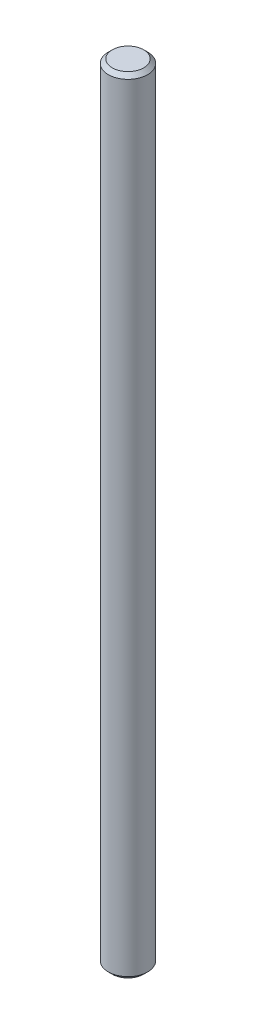
from build123d import *

# Parameters (mm, degrees)
SKETCH1_R           = 5
BOSS_EXTRUDE1_DEPTH = 200
CHAMFER1_SIZE       = 1


with BuildPart() as part:
    # Sketch1 → Boss-Extrude1 (new body)
    with BuildSketch(Plane(origin=(0, 0, 0), x_dir=(1, 0, 0), z_dir=(0, 1, 0))):
        with Locations(Location((0, 0, 0), (0, 0, 270))):
            Circle(SKETCH1_R)
    extrude(amount=BOSS_EXTRUDE1_DEPTH)

    # Chamfer1
    chamfer1_edges = [part.edges().sort_by_distance(p)[0] for p in [
        (0, 0, -5),
        (0, 200, -5),
    ]]
    chamfer(chamfer1_edges, length=CHAMFER1_SIZE)


solid = part.part
